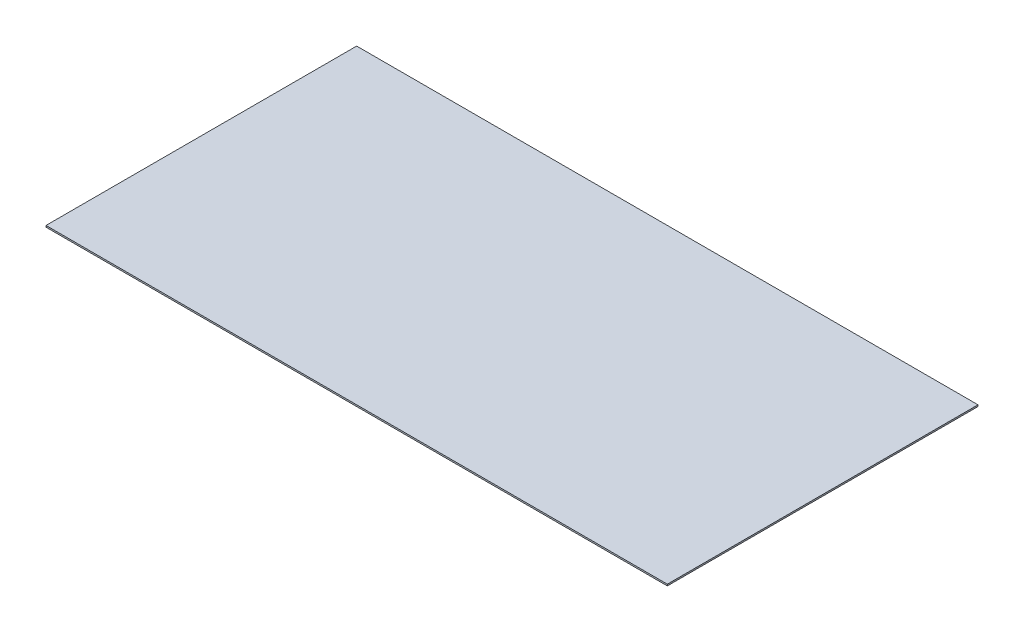
from build123d import *

# Parameters (mm, degrees)
SKETCH1_W           = 1200
SKETCH1_H           = 600
BOSS_EXTRUDE1_DEPTH = 3


with BuildPart() as part:
    # Sketch1 → Boss-Extrude1 (new body)
    with BuildSketch(Plane(origin=(0, 0, 0), x_dir=(1, 0, 0), z_dir=(0, 1, 0))):
        Rectangle(SKETCH1_W, SKETCH1_H)
    extrude(amount=BOSS_EXTRUDE1_DEPTH)


solid = part.part
